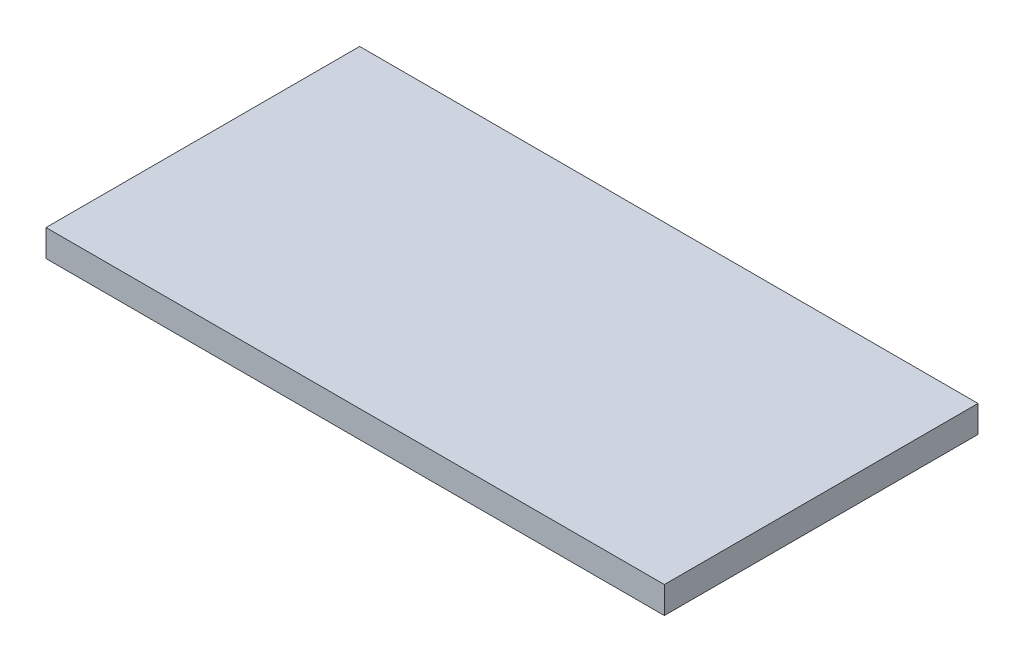
from build123d import *

# Parameters (mm, degrees)
SKETCH1_W           = 69
SKETCH1_H           = 35
BOSS_EXTRUDE1_DEPTH = 3


with BuildPart() as part:
    # Sketch1 → Boss-Extrude1 (new body)
    with BuildSketch(Plane(origin=(0, 0, 0), x_dir=(1, 0, 0), z_dir=(0, 1, 0))):
        Rectangle(SKETCH1_W, SKETCH1_H)
    extrude(amount=BOSS_EXTRUDE1_DEPTH)


solid = part.part
